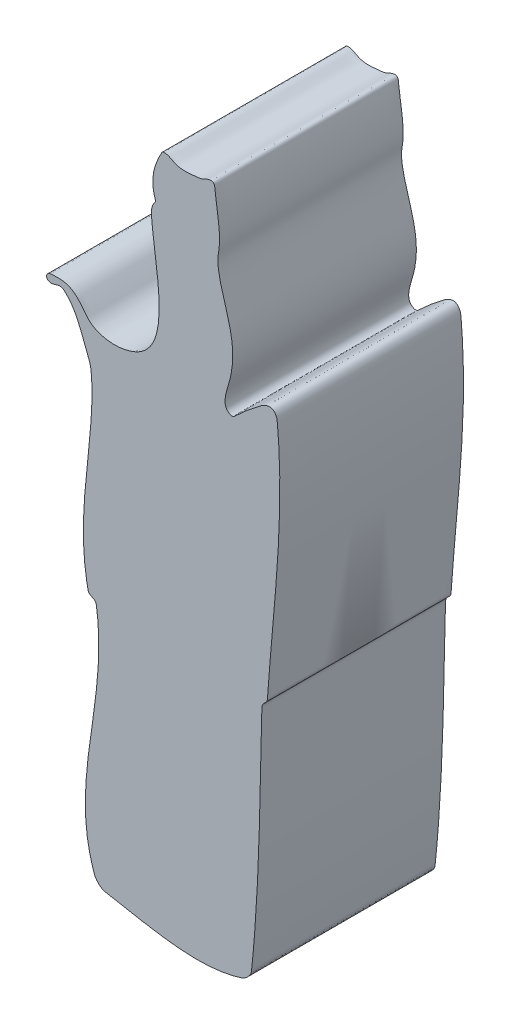
from build123d import *

# Parameters (mm, degrees)
CADVIEW_CORE_EXTRUDE_DEPTH = 13.031278932


with BuildPart() as part:
    # CADView Core Profile → CADView Core Extrude (new body)
    with BuildSketch(Plane.XY):
        with BuildLine():
            add(Edge.make_bspline(
                [(-2.843273176, 9.40057428), (-0.19551906, 10.581540778), (-1.556233667, 15.466978521), (-1.754974623, 18.951478354), (-1.394010978, 19.345515772), (-1.829490989, 20.49095824), (-1.517650014, 21.629028961), (-0.936987808, 22.658226878), (-0.533357309, 22.698135572), (0.145146935, 22.155451652), (1.094141777, 22.282469804), (1.929810971, 22.361932043), (2.27716301, 22.611675044), (2.633674316, 22.622313833), (2.773945437, 22.468868061), (2.886821964, 21.077674032), (3.282919183, 19.653473525), (2.962891645, 17.98903535), (3.27238293, 15.428672154), (4.859488338, 12.985637258), (3.182662376, 9.1749408), (4.066546083, 8.835965419), (4.744621989, 9.501708041), (5.475365618, 10.095837228), (6.304383159, 10.738276735), (6.777362725, 10.813092223), (7.037576403, 10.645588799), (7.193528286, 10.362001657), (7.773177899, 4.385218353), (6.924615168, -1.242995647), (6.502690312, -7.503972543), (6.130506098, -7.695024895), (5.973732826, -13.744322509), (5.962056576, -18.97368016), (5.370440212, -24.725147669), (5.144445933, -25.020259438), (4.860147966, -25.255161603), (1.61585809, -26.289916038), (-1.834861992, -25.418708106), (-5.185704578, -24.830459418), (-5.473477066, -24.598569472), (-5.702649392, -24.330760458), (-7.6148459, -18.906975611), (-4.736334449, -13.326996106), (-5.665310785, -7.247335268), (-6.159922854, -7.187246029), (-7.007249058, -3.080796069), (-5.976881562, 1.299514662), (-5.906904598, 5.938317084), (-6.047496908, 7.081863794), (-6.644346103, 8.425972102), (-6.98413627, 9.835683125), (-8.232831602, 10.932970032), (-8.787540509, 10.484194738), (-9.142426675, 10.759676726), (-9.171230597, 10.9740323), (-9.010064501, 11.176950858), (-8.595512124, 11.191179274), (-8.10779076, 11.228842936), (-7.475672512, 11.071127457), (-6.729668358, 10.531949694), (-6.301812085, 9.705961693), (-4.940717787, 8.965173161), (-3.716099155, 9.027749199), (-2.8719328, 9.38779135), (-2.843273176, 9.40057428)],
                knots=[0, 0, 0, 0, 0.069437538, 0.078635085, 0.079784864, 0.081102249, 0.105271559, 0.106413678, 0.10760561, 0.114101461, 0.125680277, 0.128858949, 0.133928363, 0.135512025, 0.136709486, 0.138449727, 0.16801016, 0.171010177, 0.178596261, 0.228061818, 0.244811142, 0.245989121, 0.248909694, 0.264440651, 0.270996082, 0.272959034, 0.275371241, 0.277777019, 0.280453947, 0.416910124, 0.419234401, 0.422535306, 0.425290872, 0.554666768, 0.557457604, 0.559900654, 0.563267513, 0.566086495, 0.640124689, 0.643159193, 0.645627989, 0.648726979, 0.651431975, 0.781070916, 0.783423813, 0.787708914, 0.789885567, 0.877316765, 0.895865542, 0.899911642, 0.904544582, 0.930647743, 0.933945774, 0.940752423, 0.942217886, 0.943715343, 0.945406876, 0.947696453, 0.953067666, 0.957251641, 0.962834221, 0.974504496, 0.978204653, 0.999248399, 1, 1, 1, 1], degree=3))
        make_face()
    extrude(amount=CADVIEW_CORE_EXTRUDE_DEPTH)


solid = part.part
